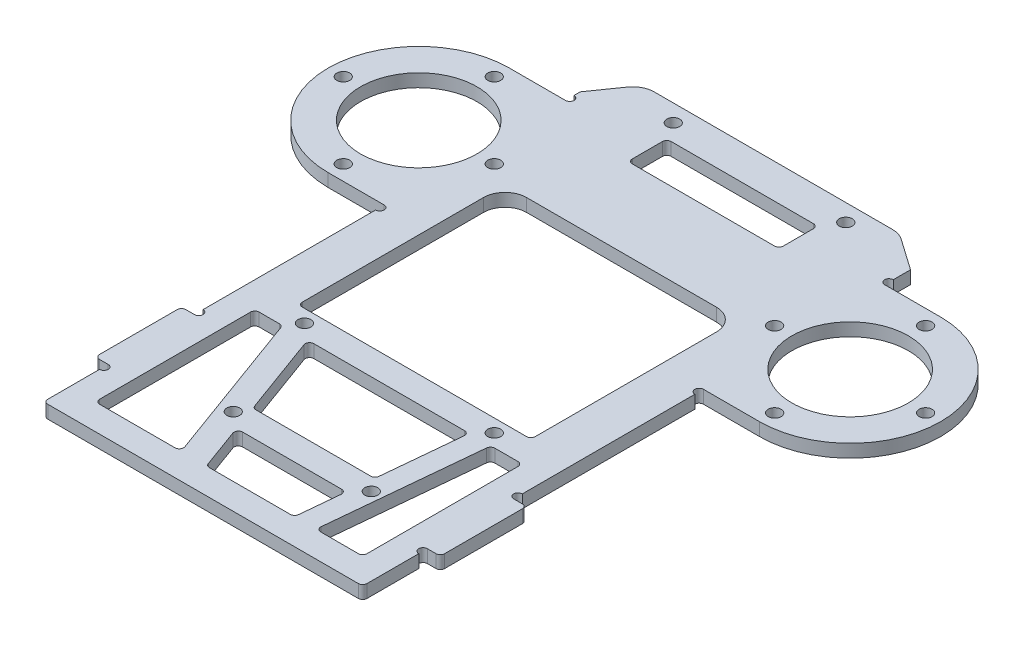
from build123d import *
from OCP.BRepFilletAPI import BRepFilletAPI_MakeChamfer

# Parameters (mm, degrees)
SKETCH_1_R          = 13.5
SKETCH_1_R_2        = 1.5
EXTRUDE_1_DEPTH     = 3
SKETCH_3_W          = 54
SKETCH_3_H          = 48
SKETCH_3_W_2        = 35
SKETCH_3_H_2        = 9
CUT_EXTRUDE_2_DEPTH = 123.678441464
SKETCH_2_R          = 1
CUT_EXTRUDE_1_DEPTH = 123.678441464
CHAMFER_1_SIZE      = 6
CHAMFER_1_SIZE2     = 8.56888804
FILLET_1_R          = 1
FILLET_2_R          = 5


with BuildPart() as part:
    # 草图1 → 凸台-拉伸1 (new body)
    with BuildSketch(Plane(origin=(0, 0, 0), x_dir=(1, 0, 0), z_dir=(0, 1, 0))):
        with BuildLine():
            Line((-37, 21), (-50, 21))
            ThreePointArc((-50, 21), (-71, 0), (-50, -21))
            Line((-50, -21), (-37, -21))
            Line((-37, -21), (-37, -65))
            Line((-37, -65), (-40, -65))
            Line((-40, -65), (-40, -85))
            Line((-40, -85), (-37, -85))
            Line((-37, -85), (-37, -100))
            Line((-37, -100), (37, -100))
            Line((37, -100), (37, -85))
            Line((37, -85), (40, -85))
            Line((40, -85), (40, -65))
            Line((40, -65), (37, -65))
            Line((37, -65), (37, -21))
            Line((37, -21), (50, -21))
            ThreePointArc((50, -21), (71, 0), (50, 21))
            Line((50, 21), (37, 21))
            Line((37, 21), (37, 33))
            Line((37, 33), (-37, 33))
            Line((-37, 33), (-37, 21))
        make_face()
        with Locations(Location((-50, 0, 0), (0, 0, 270))):
            Circle(SKETCH_1_R, mode=Mode.SUBTRACT)
        with Locations(Location((50, 0, 0), (0, 0, 90))):
            Circle(SKETCH_1_R, mode=Mode.SUBTRACT)
        with Locations(Location((-50, 17.5, 0), (0, 0, 270))):
            Circle(SKETCH_1_R_2, mode=Mode.SUBTRACT)
        with Locations(Location((-32.5, 0, 0), (0, 0, 270))):
            Circle(SKETCH_1_R_2, mode=Mode.SUBTRACT)
        with Locations(Location((-67.5, 0, 0), (0, 0, 270))):
            Circle(SKETCH_1_R_2, mode=Mode.SUBTRACT)
        with Locations(Location((-50, -17.5, 0), (0, 0, 270))):
            Circle(SKETCH_1_R_2, mode=Mode.SUBTRACT)
        with Locations(Location((32.5, 0, 0), (0, 0, 270))):
            Circle(SKETCH_1_R_2, mode=Mode.SUBTRACT)
        with Locations(Location((50, -17.5, 0), (0, 0, 270))):
            Circle(SKETCH_1_R_2, mode=Mode.SUBTRACT)
        with Locations(Location((50, 17.5, 0), (0, 0, 270))):
            Circle(SKETCH_1_R_2, mode=Mode.SUBTRACT)
        with Locations(Location((67.5, 0, 0), (0, 0, 270))):
            Circle(SKETCH_1_R_2, mode=Mode.SUBTRACT)
        with Locations(Location((-20, 29, 0), (0, 0, 270))):
            Circle(SKETCH_1_R_2, mode=Mode.SUBTRACT)
        with Locations(Location((20, 29, 0), (0, 0, 90))):
            Circle(SKETCH_1_R_2, mode=Mode.SUBTRACT)
        with Locations(Location((21.5, -54, 0), (0, 0, 270))):
            Circle(SKETCH_1_R_2, mode=Mode.SUBTRACT)
        with Locations(Location((-13, -80, 0), (0, 0, 270))):
            Circle(SKETCH_1_R_2, mode=Mode.SUBTRACT)
        with Locations(Location((19, -80, 0), (0, 0, 270))):
            Circle(SKETCH_1_R_2, mode=Mode.SUBTRACT)
        with Locations(Location((-22.5, -54, 0), (0, 0, 270))):
            Circle(SKETCH_1_R_2, mode=Mode.SUBTRACT)
    extrude(amount=EXTRUDE_1_DEPTH)

    # 草图3 → 切除-拉伸2 (cut, through all)
    with BuildSketch(Plane(origin=(0, 3, 0), x_dir=(1, 0, 0), z_dir=(0, 1, 0))):
        with Locations((0, -27)):
            Rectangle(SKETCH_3_W, SKETCH_3_H)
        with Locations((0, 20.5)):
            Rectangle(SKETCH_3_W_2, SKETCH_3_H_2)
        Polygon((-24.597833201, -57), (-11.078602431, -94), (-31, -94), (-31, -57), align=None)
        Polygon((-18.742190282, -57), (18.700008099, -57), (16.776931176, -77), (-11.434497974, -77), align=None)
        Polygon((-9.242190282, -83), (-5.222959512, -94), (15.142315791, -94), (16.200008099, -83), align=None)
        Polygon((23.723068824, -57), (20.165376517, -94), (31, -94), (31, -57), align=None)
    extrude(amount=-CUT_EXTRUDE_2_DEPTH, mode=Mode.SUBTRACT)

    # 草图2 → 切除-拉伸1 (cut, through all)
    with BuildSketch(Plane(origin=(0, 3, 0), x_dir=(1, 0, 0), z_dir=(0, 1, 0))):
        with Locations((-37, 22)):
            Circle(SKETCH_2_R)
        with Locations((-37, -22)):
            Circle(SKETCH_2_R)
        with Locations((-37, -64)):
            Circle(SKETCH_2_R)
        with Locations((-37, -86)):
            Circle(SKETCH_2_R)
        with Locations((37, -86)):
            Circle(SKETCH_2_R)
        with Locations((37, -64)):
            Circle(SKETCH_2_R)
        with Locations((37, -22)):
            Circle(SKETCH_2_R)
        with Locations((37, 22)):
            Circle(SKETCH_2_R)
    extrude(amount=-CUT_EXTRUDE_1_DEPTH, mode=Mode.SUBTRACT)

    # 倒角1: one chamfer whose edges measure the first distance from different faces: ONE call of the kernel's chamfer builder (chamfer() names one face for all edges)
    chamfer_1_edges_1 = [part.edges().sort_by_distance(p)[0] for p in [
        (-37, 1.5, -33),
    ]]
    chamfer_1_side_1 = [part.faces().sort_by_distance(p)[0] for p in [
        (0, 1.5, -33),
    ]]
    chamfer_1_edges_2 = [part.edges().sort_by_distance(p)[0] for p in [
        (37, 1.5, -33),
    ]]
    chamfer_1_side_2 = [part.faces().sort_by_distance(p)[0] for p in [
        (37, 1.5, -28),
    ]]
    chamfer_1 = BRepFilletAPI_MakeChamfer(part.part.solid().wrapped)
    for e in chamfer_1_edges_1:
        chamfer_1.Add(CHAMFER_1_SIZE, CHAMFER_1_SIZE2, e.wrapped, chamfer_1_side_1[0].wrapped)  # the first distance lies on this face
    for e in chamfer_1_edges_2:
        chamfer_1.Add(CHAMFER_1_SIZE, CHAMFER_1_SIZE2, e.wrapped, chamfer_1_side_2[0].wrapped)  # the first distance lies on this face
    add(Compound.cast(chamfer_1.Shape()), mode=Mode.REPLACE)

    # 圆角1
    fillet_1_edges = [part.edges().sort_by_distance(p)[0] for p in [
        (23.723068824, 1.5, 57),
        (31, 1.5, 57),
        (31, 1.5, 94),
        (20.165376517, 1.5, 94),
        (-17.5, 1.5, -16),
        (-17.5, 1.5, -25),
        (17.5, 1.5, -25),
        (17.5, 1.5, -16),
        (-11.434497974, 1.5, 77),
        (-18.742190282, 1.5, 57),
        (18.700008099, 1.5, 57),
        (16.776931176, 1.5, 77),
        (-11.078602431, 1.5, 94),
        (-31, 1.5, 94),
        (-31, 1.5, 57),
        (-24.597833201, 1.5, 57),
        (-9.242190282, 1.5, 83),
        (16.200008099, 1.5, 83),
        (15.142315791, 1.5, 94),
        (-5.222959512, 1.5, 94),
        (-27, 1.5, 51),
        (27, 1.5, 51),
        (40, 1.5, 65),
        (40, 1.5, 85),
        (37, 1.5, 100),
        (-37, 1.5, 100),
        (-40, 1.5, 85),
        (-40, 1.5, 65),
    ]]
    fillet(fillet_1_edges, radius=FILLET_1_R)

    # 圆角2
    fillet_2_edges = [part.edges().sort_by_distance(p)[0] for p in [
        (-27, 1.5, 3),
        (27, 1.5, 3),
        (-31, 1.5, -33),
        (28.43111196, 1.5, -33),
    ]]
    fillet(fillet_2_edges, radius=FILLET_2_R)


solid = part.part
